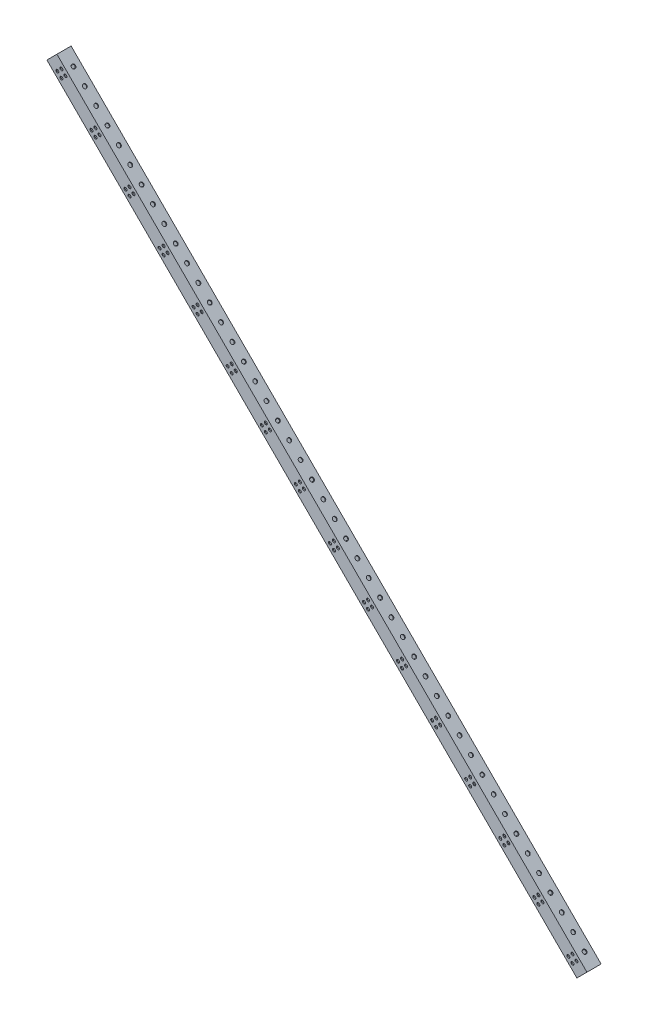
from build123d import *

# Parameters (mm, degrees)
EXTRUDE_1_DEPTH     = 15
SKETCH_3_W          = 13
SKETCH_3_H          = 13
CUT_EXTRUDE_2_DEPTH = 791.959594929
SKETCH_4_R          = 1.6
CUT_EXTRUDE_3_DEPTH = 15
SKETCH_5_R          = 2.1
CUT_EXTRUDE_4_DEPTH = 15


with BuildPart() as part:
    # 草图1 → 凸台-拉伸1 (new body)
    with BuildSketch(Plane.XY):
        Polygon((5.303300859, 565.303300859), (-5.303300859, 554.696699141), (554.696699141, -5.303300859), (565.303300859, 5.303300859), align=None)
    extrude(amount=EXTRUDE_1_DEPTH)

    # 草图3 → 切除-拉伸2 (cut)
    with BuildSketch(Plane(origin=(-280, 280, 0), x_dir=(0, 0, 1), z_dir=(-0.7071067811865449, 0.7071067811865501, 0))):
        with Locations((7.5, 395.979797464)):
            Rectangle(SKETCH_3_W, SKETCH_3_H)
    extrude(amount=-CUT_EXTRUDE_2_DEPTH, mode=Mode.SUBTRACT)

    # 草图4 → 切除-拉伸3 (cut)
    with BuildSketch(Plane.XY.offset(15)):
        with Locations((5.757359313, 550)):
            Circle(SKETCH_4_R)
        with Locations((10, 554.242640687)):
            Circle(SKETCH_4_R)
        with Locations((10, 545.757359313)):
            Circle(SKETCH_4_R)
        with Locations((14.242640687, 550)):
            Circle(SKETCH_4_R)
        with Locations((41.757359316, 513.999999997)):
            Circle(SKETCH_4_R)
        with Locations((46.000000003, 518.242640684)):
            Circle(SKETCH_4_R)
        with Locations((50.24264069, 513.999999997)):
            Circle(SKETCH_4_R)
        with Locations((46.000000003, 509.75735931)):
            Circle(SKETCH_4_R)
        with Locations((77.757359319, 477.999999994)):
            Circle(SKETCH_4_R)
        with Locations((82.000000006, 482.242640681)):
            Circle(SKETCH_4_R)
        with Locations((86.242640694, 477.999999994)):
            Circle(SKETCH_4_R)
        with Locations((82.000000006, 473.757359306)):
            Circle(SKETCH_4_R)
        with Locations((113.757359323, 441.99999999)):
            Circle(SKETCH_4_R)
        with Locations((118.00000001, 446.242640677)):
            Circle(SKETCH_4_R)
        with Locations((122.242640697, 441.99999999)):
            Circle(SKETCH_4_R)
        with Locations((118.00000001, 437.757359303)):
            Circle(SKETCH_4_R)
        with Locations((149.757359326, 405.999999987)):
            Circle(SKETCH_4_R)
        with Locations((154.000000013, 410.242640674)):
            Circle(SKETCH_4_R)
        with Locations((158.2426407, 405.999999987)):
            Circle(SKETCH_4_R)
        with Locations((154.000000013, 401.7573593)):
            Circle(SKETCH_4_R)
        with Locations((185.757359329, 369.999999984)):
            Circle(SKETCH_4_R)
        with Locations((190.000000016, 374.242640671)):
            Circle(SKETCH_4_R)
        with Locations((194.242640703, 369.999999984)):
            Circle(SKETCH_4_R)
        with Locations((190.000000016, 365.757359297)):
            Circle(SKETCH_4_R)
        with Locations((221.757359332, 333.999999981)):
            Circle(SKETCH_4_R)
        with Locations((226.000000019, 338.242640668)):
            Circle(SKETCH_4_R)
        with Locations((230.242640707, 333.999999981)):
            Circle(SKETCH_4_R)
        with Locations((226.000000019, 329.757359293)):
            Circle(SKETCH_4_R)
        with Locations((257.757359335, 297.999999977)):
            Circle(SKETCH_4_R)
        with Locations((262.000000023, 302.242640665)):
            Circle(SKETCH_4_R)
        with Locations((266.24264071, 297.999999977)):
            Circle(SKETCH_4_R)
        with Locations((262.000000023, 293.75735929)):
            Circle(SKETCH_4_R)
        with Locations((293.757359339, 261.999999974)):
            Circle(SKETCH_4_R)
        with Locations((298.000000026, 266.242640661)):
            Circle(SKETCH_4_R)
        with Locations((302.242640713, 261.999999974)):
            Circle(SKETCH_4_R)
        with Locations((298.000000026, 257.757359287)):
            Circle(SKETCH_4_R)
        with Locations((329.757359342, 225.999999971)):
            Circle(SKETCH_4_R)
        with Locations((334.000000029, 230.242640658)):
            Circle(SKETCH_4_R)
        with Locations((338.242640716, 225.999999971)):
            Circle(SKETCH_4_R)
        with Locations((334.000000029, 221.757359284)):
            Circle(SKETCH_4_R)
        with Locations((365.757359345, 189.999999968)):
            Circle(SKETCH_4_R)
        with Locations((370.000000032, 194.242640655)):
            Circle(SKETCH_4_R)
        with Locations((374.242640719, 189.999999968)):
            Circle(SKETCH_4_R)
        with Locations((370.000000032, 185.757359281)):
            Circle(SKETCH_4_R)
        with Locations((401.757359348, 153.999999964)):
            Circle(SKETCH_4_R)
        with Locations((406.000000036, 158.242640652)):
            Circle(SKETCH_4_R)
        with Locations((410.242640723, 153.999999964)):
            Circle(SKETCH_4_R)
        with Locations((406.000000036, 149.757359277)):
            Circle(SKETCH_4_R)
        with Locations((437.757359352, 117.999999961)):
            Circle(SKETCH_4_R)
        with Locations((442.000000039, 122.242640648)):
            Circle(SKETCH_4_R)
        with Locations((446.242640726, 117.999999961)):
            Circle(SKETCH_4_R)
        with Locations((442.000000039, 113.757359274)):
            Circle(SKETCH_4_R)
        with Locations((473.757359355, 81.999999958)):
            Circle(SKETCH_4_R)
        with Locations((478.000000042, 86.242640645)):
            Circle(SKETCH_4_R)
        with Locations((482.242640729, 81.999999958)):
            Circle(SKETCH_4_R)
        with Locations((478.000000042, 77.757359271)):
            Circle(SKETCH_4_R)
        with Locations((509.757359358, 45.999999955)):
            Circle(SKETCH_4_R)
        with Locations((514.000000045, 50.242640642)):
            Circle(SKETCH_4_R)
        with Locations((518.242640732, 45.999999955)):
            Circle(SKETCH_4_R)
        with Locations((514.000000045, 41.757359268)):
            Circle(SKETCH_4_R)
        with Locations((545.757359361, 9.999999952)):
            Circle(SKETCH_4_R)
        with Locations((550.000000048, 14.242640639)):
            Circle(SKETCH_4_R)
        with Locations((554.242640736, 9.999999952)):
            Circle(SKETCH_4_R)
        with Locations((550.000000048, 5.757359264)):
            Circle(SKETCH_4_R)
    extrude(amount=-CUT_EXTRUDE_3_DEPTH, mode=Mode.SUBTRACT)

    # 草图5 → 切除-拉伸4 (cut)
    with BuildSketch(Plane(origin=(274.696699141, 274.696699141, 0), x_dir=(0, 0, 1), z_dir=(-0.7071067811865503, -0.7071067811865447, 0))):
        with Locations(Location((7.5, 381.837661841, 0), (0, 0, 270))):
            Circle(SKETCH_5_R)
        with Locations(Location((7.5, 364.867099092, 0), (0, 0, 270))):
            Circle(SKETCH_5_R)
        with Locations(Location((7.5, 347.896536344, 0), (0, 0, 270))):
            Circle(SKETCH_5_R)
        with Locations(Location((7.5, 330.925973595, 0), (0, 0, 270))):
            Circle(SKETCH_5_R)
        with Locations(Location((7.5, 313.955410847, 0), (0, 0, 270))):
            Circle(SKETCH_5_R)
        with Locations(Location((7.5, 296.984848098, 0), (0, 0, 270))):
            Circle(SKETCH_5_R)
        with Locations(Location((7.5, 280.01428535, 0), (0, 0, 270))):
            Circle(SKETCH_5_R)
        with Locations(Location((7.5, 263.043722601, 0), (0, 0, 270))):
            Circle(SKETCH_5_R)
        with Locations(Location((7.5, 246.073159853, 0), (0, 0, 270))):
            Circle(SKETCH_5_R)
        with Locations(Location((7.5, 229.102597104, 0), (0, 0, 270))):
            Circle(SKETCH_5_R)
        with Locations(Location((7.5, 212.132034356, 0), (0, 0, 270))):
            Circle(SKETCH_5_R)
        with Locations(Location((7.5, 195.161471607, 0), (0, 0, 270))):
            Circle(SKETCH_5_R)
        with Locations(Location((7.5, 178.190908859, 0), (0, 0, 270))):
            Circle(SKETCH_5_R)
        with Locations(Location((7.5, 161.220346111, 0), (0, 0, 270))):
            Circle(SKETCH_5_R)
        with Locations(Location((7.5, 144.249783362, 0), (0, 0, 270))):
            Circle(SKETCH_5_R)
        with Locations(Location((7.5, 127.279220614, 0), (0, 0, 270))):
            Circle(SKETCH_5_R)
        with Locations(Location((7.5, 110.308657865, 0), (0, 0, 270))):
            Circle(SKETCH_5_R)
        with Locations(Location((7.5, 93.338095117, 0), (0, 0, 270))):
            Circle(SKETCH_5_R)
        with Locations(Location((7.5, 76.367532368, 0), (0, 0, 270))):
            Circle(SKETCH_5_R)
        with Locations(Location((7.5, 59.39696962, 0), (0, 0, 270))):
            Circle(SKETCH_5_R)
        with Locations(Location((7.5, 42.426406871, 0), (0, 0, 270))):
            Circle(SKETCH_5_R)
        with Locations(Location((7.5, 25.455844123, 0), (0, 0, 270))):
            Circle(SKETCH_5_R)
        with Locations(Location((7.5, 8.485281374, 0), (0, 0, 270))):
            Circle(SKETCH_5_R)
        with Locations(Location((7.5, -8.485281374, 0), (0, 0, 270))):
            Circle(SKETCH_5_R)
        with Locations(Location((7.5, -25.455844123, 0), (0, 0, 270))):
            Circle(SKETCH_5_R)
        with Locations(Location((7.5, -42.426406871, 0), (0, 0, 270))):
            Circle(SKETCH_5_R)
        with Locations(Location((7.5, -59.39696962, 0), (0, 0, 270))):
            Circle(SKETCH_5_R)
        with Locations(Location((7.5, -76.367532368, 0), (0, 0, 270))):
            Circle(SKETCH_5_R)
        with Locations(Location((7.5, -93.338095117, 0), (0, 0, 270))):
            Circle(SKETCH_5_R)
        with Locations(Location((7.5, -110.308657865, 0), (0, 0, 270))):
            Circle(SKETCH_5_R)
        with Locations(Location((7.5, -127.279220614, 0), (0, 0, 270))):
            Circle(SKETCH_5_R)
        with Locations(Location((7.5, -144.249783362, 0), (0, 0, 270))):
            Circle(SKETCH_5_R)
        with Locations(Location((7.5, -161.220346111, 0), (0, 0, 270))):
            Circle(SKETCH_5_R)
        with Locations(Location((7.5, -178.190908859, 0), (0, 0, 270))):
            Circle(SKETCH_5_R)
        with Locations(Location((7.5, -195.161471607, 0), (0, 0, 270))):
            Circle(SKETCH_5_R)
        with Locations(Location((7.5, -212.132034356, 0), (0, 0, 270))):
            Circle(SKETCH_5_R)
        with Locations(Location((7.5, -229.102597104, 0), (0, 0, 270))):
            Circle(SKETCH_5_R)
        with Locations(Location((7.5, -246.073159853, 0), (0, 0, 270))):
            Circle(SKETCH_5_R)
        with Locations(Location((7.5, -263.043722601, 0), (0, 0, 270))):
            Circle(SKETCH_5_R)
        with Locations(Location((7.5, -280.01428535, 0), (0, 0, 270))):
            Circle(SKETCH_5_R)
        with Locations(Location((7.5, -296.984848098, 0), (0, 0, 270))):
            Circle(SKETCH_5_R)
        with Locations(Location((7.5, -313.955410847, 0), (0, 0, 270))):
            Circle(SKETCH_5_R)
        with Locations(Location((7.5, -330.925973595, 0), (0, 0, 270))):
            Circle(SKETCH_5_R)
        with Locations(Location((7.5, -347.896536344, 0), (0, 0, 270))):
            Circle(SKETCH_5_R)
        with Locations(Location((7.5, -364.867099092, 0), (0, 0, 270))):
            Circle(SKETCH_5_R)
        with Locations(Location((7.5, -381.837661841, 0), (0, 0, 270))):
            Circle(SKETCH_5_R)
    extrude(amount=-CUT_EXTRUDE_4_DEPTH, mode=Mode.SUBTRACT)


solid = part.part
